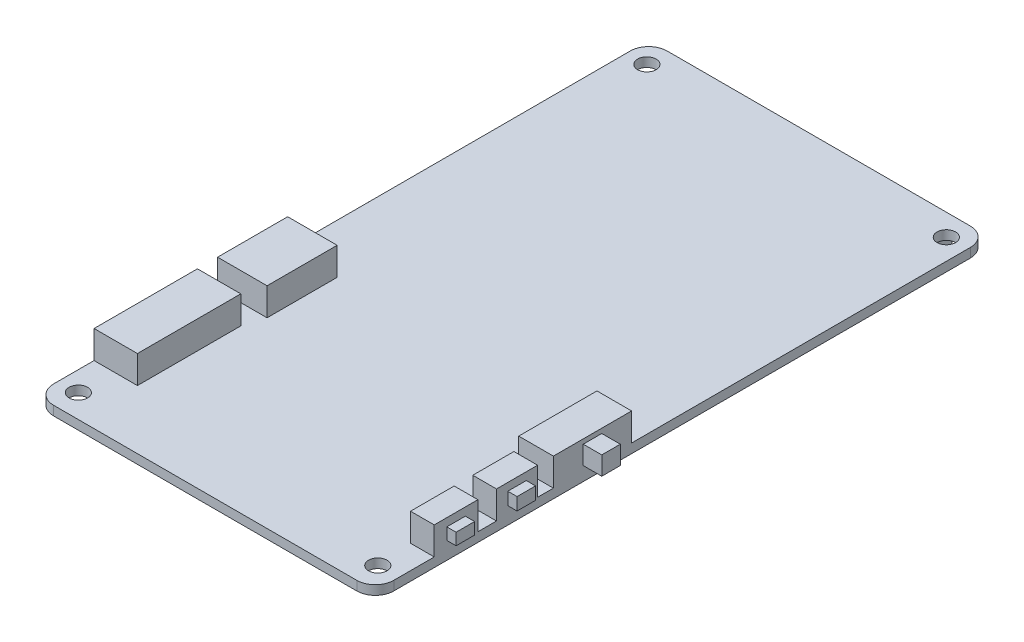
from build123d import *

# Parameters (mm, degrees)
SKETCH5_W           = 36.75
SKETCH5_H           = 66.29
BOSS_EXTRUDE3_DEPTH = 1
FILLET1_R           = 2
FILLET2_R           = 2
SKETCH7_R           = 1
CUT_EXTRUDE1_DEPTH  = 2
SKETCH9_W           = 4.683907435
SKETCH9_H           = 11.166934783
SKETCH9_W_2         = 3.743745131
SKETCH9_H_2         = 8.450578132
SKETCH9_W_3         = 2.561846092
SKETCH9_H_3         = 4.440718541
SKETCH9_H_4         = 4.716987875
SKETCH9_W_4         = 5.346352719
SKETCH9_H_5         = 7.570803243
BOSS_EXTRUDE5_DEPTH = 3
SKETCH11_W          = 2
SKETCH11_H          = 1.271998182
SKETCH11_H_2        = 1.351132692
BOSS_EXTRUDE6_DEPTH = 1
SKETCH12_W          = 2
SKETCH12_H          = 2
BOSS_EXTRUDE7_DEPTH = 2
SKETCH13_W          = 29.25
SKETCH13_H          = 59.29
BOSS_EXTRUDE8_DEPTH = 1.5


with BuildPart() as part:
    # Sketch5 → Boss-Extrude3 (new body)
    with BuildSketch(Plane(origin=(0, 0, 0), x_dir=(1, 0, 0), z_dir=(0, 1, 0))):
        with Locations((18.375, 33.145)):
            Rectangle(SKETCH5_W, SKETCH5_H)
    extrude(amount=BOSS_EXTRUDE3_DEPTH)

    # Fillet1
    fillet1_edges = [part.edges().sort_by_distance(p)[0] for p in [
        (0, 0.5, 0),
    ]]
    fillet(fillet1_edges, radius=FILLET1_R)

    # Fillet2
    fillet2_edges = [part.edges().sort_by_distance(p)[0] for p in [
        (0, 0.5, -66.29),
        (36.75, 0.5, -66.29),
        (36.75, 0.5, 0),
    ]]
    fillet(fillet2_edges, radius=FILLET2_R)

    # Sketch7 → Cut-Extrude1 (cut)
    with BuildSketch(Plane(origin=(0, 1, 0), x_dir=(1, 0, 0), z_dir=(0, 1, 0))):
        with Locations(Location((2.15, 63.94, 0), (0, 0, 270))):
            Circle(SKETCH7_R)
        with Locations(Location((34.5, 63.94, 0), (0, 0, 270))):
            Circle(SKETCH7_R)
        with Locations(Location((2.15, 2.52, 0), (0, 0, 270))):
            Circle(SKETCH7_R)
        with Locations(Location((34.5, 2.52, 0), (0, 0, 270))):
            Circle(SKETCH7_R)
    extrude(amount=-CUT_EXTRUDE1_DEPTH, mode=Mode.SUBTRACT)

    # Sketch9 → Boss-Extrude5 (add)
    with BuildSketch(Plane(origin=(0, 1, 0), x_dir=(1, 0, 0), z_dir=(0, 1, 0))):
        with Locations((2.341953718, 11.952713426)):
            Rectangle(SKETCH9_W, SKETCH9_H)
        with Locations((34.878127435, 23.466626346)):
            Rectangle(SKETCH9_W_2, SKETCH9_H_2)
        with Locations((35.469076954, 15.315821547)):
            Rectangle(SKETCH9_W_3, SKETCH9_H_3)
        with Locations((35.469076954, 8.727739972)):
            Rectangle(SKETCH9_W_3, SKETCH9_H_4)
        with Locations((2.67317636, 23.498188372)):
            Rectangle(SKETCH9_W_4, SKETCH9_H_5)
    extrude(amount=BOSS_EXTRUDE5_DEPTH)

    # Sketch11 → Boss-Extrude6 (add)
    with BuildSketch(Plane(origin=(36.75, 0, 0), x_dir=(0, 0, -1), z_dir=(1, 0, 0))):
        with Locations((8.727739971, 2.5)):
            Rectangle(SKETCH11_W, SKETCH11_H)
        with Locations((15.315821546, 2.5)):
            Rectangle(SKETCH11_W, SKETCH11_H_2)
    extrude(amount=BOSS_EXTRUDE6_DEPTH)

    # Sketch12 → Boss-Extrude7 (add)
    with BuildSketch(Plane(origin=(36.75, 0, 0), x_dir=(0, 0, -1), z_dir=(1, 0, 0))):
        with Locations((23.466626346, 2.5)):
            Rectangle(SKETCH12_W, SKETCH12_H)
    extrude(amount=BOSS_EXTRUDE7_DEPTH)

    # Sketch13 → Boss-Extrude8 (add)
    with BuildSketch(Plane.XZ):
        with Locations((18.625, -36.145)):
            Rectangle(SKETCH13_W, SKETCH13_H)
    extrude(amount=BOSS_EXTRUDE8_DEPTH)


solid = part.part
